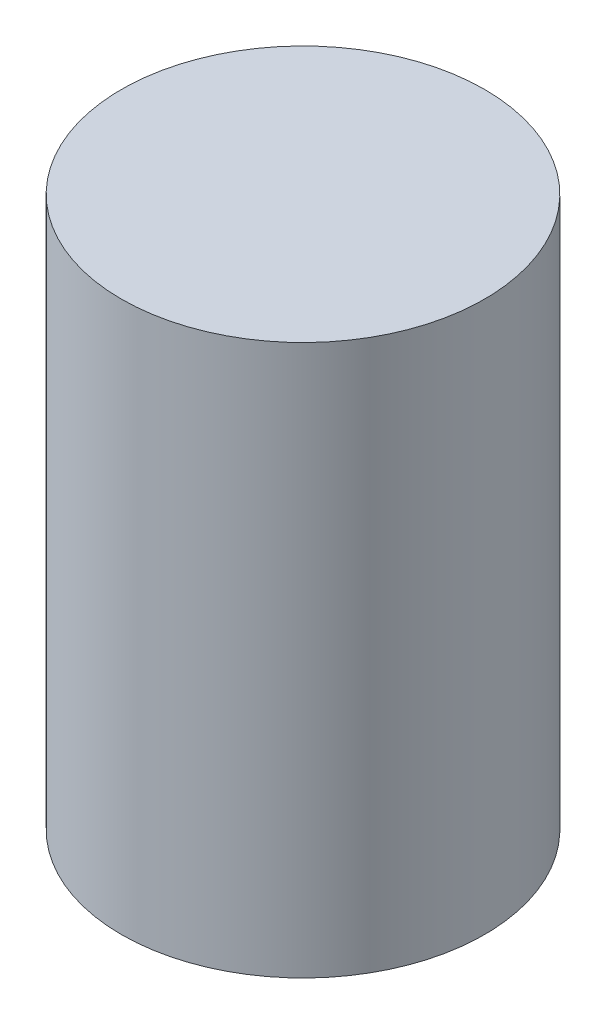
from build123d import *

# Parameters (mm, degrees)
SKETCH_1_R      = 66
EXTRUDE_1_DEPTH = 200


with BuildPart() as part:
    # Эскиз1 → Бобышка-Вытянуть1 (new body)
    with BuildSketch(Plane(origin=(0, 0, 0), x_dir=(1, 0, 0), z_dir=(0, 1, 0))):
        with Locations(Location((0, 0, 0), (0, 0, 270))):
            Circle(SKETCH_1_R)
    extrude(amount=EXTRUDE_1_DEPTH)


solid = part.part
